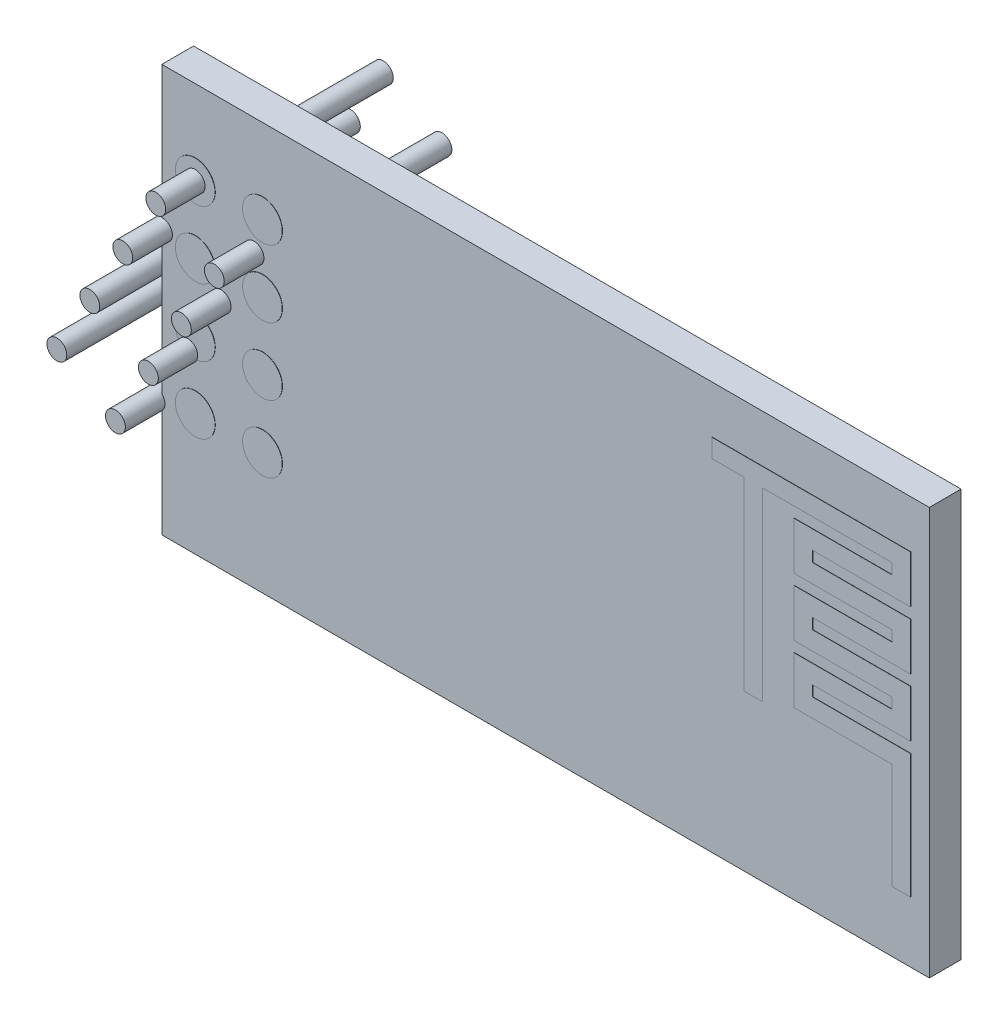
from build123d import *

# Parameters (mm, degrees)
SKETCH2_W                = 29
SKETCH2_H                = 15.4
BOSS_EXTRUDE1_DEPTH      = 1.2
SKETCH3_R                = 0.75
BOSS_EXTRUDE2_DEPTH      = 0.01
BOSS_EXTRUDE3_DEPTH      = 1.5
BOSS_EXTRUDE3_DEPTH_BACK = 7.1
SKETCH4_R                = 0.375
BOSS_EXTRUDE4_DEPTH      = 0.01
SKETCH6_W                = 5
SKETCH6_H                = 10.4
BOSS_EXTRUDE5_DEPTH      = 2.2


with BuildPart() as part:
    # Sketch2 → Boss-Extrude1 (new body)
    with BuildSketch(Plane.XY):
        with Locations((14.5, 7.7)):
            Rectangle(SKETCH2_W, SKETCH2_H)
    extrude(amount=BOSS_EXTRUDE1_DEPTH)

    # Sketch3 → Boss-Extrude2 (add)
    with BuildSketch(Plane.XY.offset(1.2)):
        with Locations(Location((1.27, 12.225, 0), (0, 0, 180))):
            Circle(SKETCH3_R)
        with Locations(Location((3.81, 12.225, 0), (0, 0, 180))):
            Circle(SKETCH3_R)
        with Locations(Location((3.81, 9.685, 0), (0, 0, 180))):
            Circle(SKETCH3_R)
        with Locations(Location((3.81, 7.145, 0), (0, 0, 180))):
            Circle(SKETCH3_R)
        with Locations(Location((3.81, 4.605, 0), (0, 0, 180))):
            Circle(SKETCH3_R)
        with Locations(Location((1.27, 9.685, 0), (0, 0, 180))):
            Circle(SKETCH3_R)
        with Locations(Location((1.27, 7.145, 0), (0, 0, 180))):
            Circle(SKETCH3_R)
        with Locations(Location((1.27, 4.605, 0), (0, 0, 180))):
            Circle(SKETCH3_R)
    extrude(amount=BOSS_EXTRUDE2_DEPTH)

    # Sketch4 → Boss-Extrude3 (add, two sides: drawn at the far end of the back side and taken through both)
    with BuildSketch(Plane.XY.offset(1.2).offset(-BOSS_EXTRUDE3_DEPTH_BACK)):
        with Locations((1.27, 12.225)):
            Circle(SKETCH4_R)
        with Locations((3.483336278, 10.978909104)):
            Circle(SKETCH4_R)
        with Locations((2.237245381, 8.765572826)):
            Circle(SKETCH4_R)
        with Locations((0.991154485, 6.552236548)):
            Circle(SKETCH4_R)
        with Locations((-0.254936412, 4.338900271)):
            Circle(SKETCH4_R)
        with Locations((0.023909104, 10.011663722)):
            Circle(SKETCH4_R)
        with Locations((-1.222181793, 7.798327445)):
            Circle(SKETCH4_R)
        with Locations((-2.468272689, 5.584991167)):
            Circle(SKETCH4_R)
    extrude(amount=BOSS_EXTRUDE3_DEPTH + BOSS_EXTRUDE3_DEPTH_BACK)


with BuildPart() as boss_extrude3_piece_1:
    # of the separate pieces the step leaves, piece 1, a body of its own (boss_extrude3_pieces)
    add(part.part.solids().sort_by_distance((0, 0, 0))[0])

    # Sketch5 → Boss-Extrude4 (add)
    with BuildSketch(Plane.XY.offset(1.2)):
        Polygon((20.8, 13.6), (28.3, 13.6), (28.3, 11.8), (24.6, 11.8), (24.6, 11.4), (28.3, 11.4), (28.3, 9.6), (24.6, 9.6), (24.6, 9.2), (28.3, 9.2), (28.3, 7.4), (24.6, 7.4), (24.6, 7), (28.3, 7), (28.3, 2.3), (27.6, 2.3), (27.6, 6.3), (23.9, 6.3), (23.9, 8.1), (27.6, 8.1), (27.6, 8.5), (23.9, 8.5), (23.9, 10.3), (27.6, 10.3), (27.6, 10.7), (23.9, 10.7), (23.9, 12.5), (27.6, 12.5), (27.6, 12.9), (22.7, 12.9), (22.7, 5.9), (22, 5.9), (22, 12.9), (20.8, 12.9), align=None)
    extrude(amount=BOSS_EXTRUDE4_DEPTH)


with BuildPart() as boss_extrude3_piece_2:
    # of the separate pieces the step leaves, piece 2, a body of its own (boss_extrude3_pieces)
    add(part.part.solids().sort_by_distance((-0.847181793, 7.798327445, 1.2))[0])


with BuildPart() as boss_extrude3_piece_3:
    # of the separate pieces the step leaves, piece 3, a body of its own (boss_extrude3_pieces)
    add(part.part.solids().sort_by_distance((-2.093272689, 5.584991167, 1.2))[0])


with BuildPart() as body_4:
    # Sketch6 → Boss-Extrude5 (new body)
    with BuildSketch(Plane(origin=(0, 0, 0), x_dir=(-1, 0, 0), z_dir=(0, 0, -1))):
        with Locations((-2.6, 7.7)):
            Rectangle(SKETCH6_W, SKETCH6_H)
    extrude(amount=BOSS_EXTRUDE5_DEPTH)


solid = Compound([boss_extrude3_piece_1.part, boss_extrude3_piece_2.part, boss_extrude3_piece_3.part, body_4.part])
